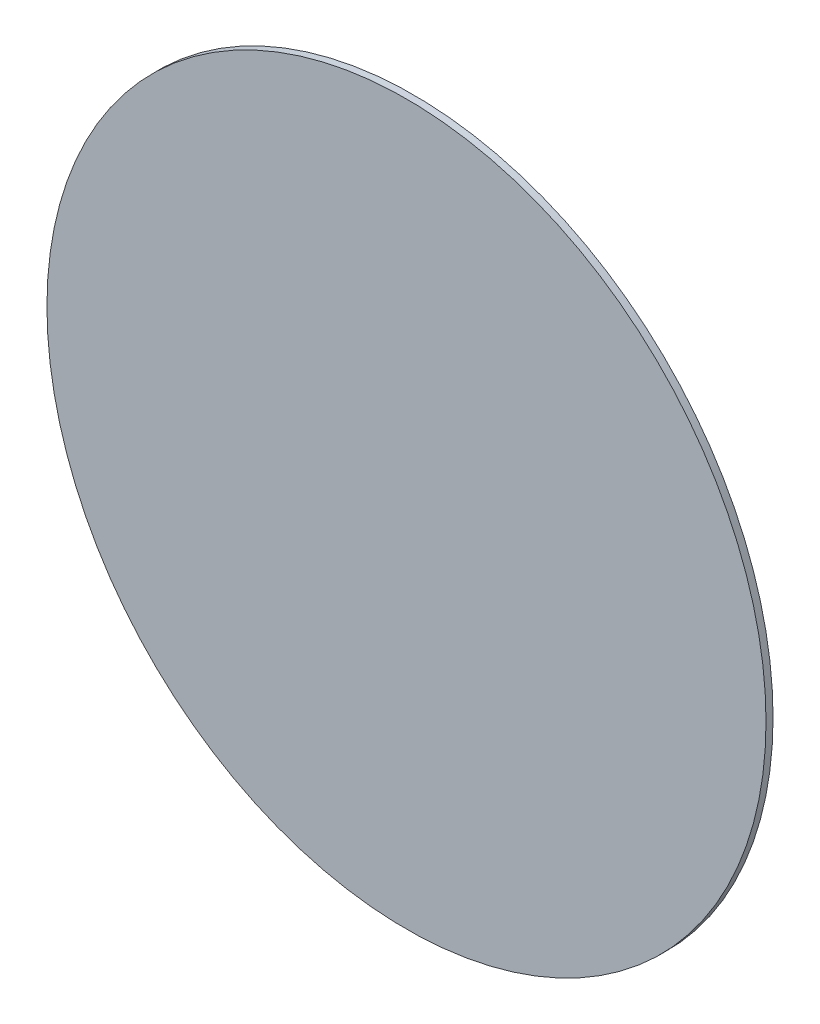
from build123d import *

# Parameters (mm, degrees)
ESQUISSE1_R         = 13.3
BOSS_EXTRU_1_DEPTH  = 0.26
BALAYAGE1_PROFILE_R = 0.125


with BuildPart() as part:
    # Esquisse1 → Boss.-Extru.1 (new body)
    with BuildSketch(Plane.XY):
        Circle(ESQUISSE1_R)
    extrude(amount=BOSS_EXTRU_1_DEPTH)


with BuildPart() as body_2:
    # Balayage1: sweep along a curve in space
    with BuildLine() as balayage1_path:
        add(Edge.make_bspline(
            [(0, -12.115, -0.125), (1.387618568, -12.110260417, -0.125), (2.773256488, -11.864807262, -0.125), (5.380004354, -10.922030278, -0.125), (6.600514993, -10.22493249, -0.125), (8.734753164, -8.461145826, -0.125), (9.647993153, -7.394871199, -0.125), (11.061596095, -5.017978902, -0.125), (11.561639948, -3.707914867, -0.125), (12.091223071, -0.996932111, -0.125), (12.120648557, 0.403358575, -0.125), (11.706449744, 3.131057582, -0.125), (11.262929781, 4.457836991, -0.125), (9.955544639, 6.883673874, -0.125), (9.091989217, 7.982175011, -0.125), (7.046202055, 9.823575173, -0.125), (5.86444883, 10.566055241, -0.125), (3.320910255, 11.609363239, -0.125), (1.959715895, 11.909958198, -0.125), (-0.783364404, 12.035226494, -0.125), (-2.164616166, 11.859879613, -0.125), (-4.786431859, 11.054654814, -0.125), (-6.026392594, 10.424971291, -0.125), (-8.221059365, 8.785493841, -0.125), (-9.175263561, 7.776085706, -0.125), (-10.68750614, 5.495792698, -0.125), (-11.245202406, 4.225439506, -0.125), (-11.90004643, 1.572143517, -0.125), (-11.997051371, 0.189815847, -0.125), (-11.720066637, -2.525748083, -0.125), (-11.346149648, -3.85835781, -0.125), (-10.171902992, -6.318923135, -0.125), (-9.371852515, -7.446313991, -0.125), (-7.439611208, -9.365149732, -0.125), (-6.307872972, -10.156157474, -0.125), (-3.845090777, -11.310480775, -0.125), (-2.514619542, -11.673537541, -0.125), (0.189836756, -11.930378205, -0.125), (1.56319614, -11.824111457, -0.125), (4.192928391, -11.155625797, -0.125), (5.448695821, -10.593569803, -0.125), (7.696790355, -9.080040562, -0.125), (8.688602925, -8.128924256, -0.125), (10.293450065, -5.949125713, -0.125), (10.906120875, -4.720952289, -0.125), (11.681857662, -2.13103609, -0.125), (11.844752775, -0.769894213, -0.125), (11.702786475, 1.926710636, -0.125), (11.397966586, 3.261551027, -0.125), (10.357086705, 5.749687097, -0.125), (9.621275264, 6.902411272, -0.125), (7.805200563, 8.89202576, -0.125), (6.725363354, 9.728462269, -0.125), (4.348040617, 10.988419432, -0.125), (3.051108451, 11.411656695, -0.125), (0.391509452, 11.796588052, -0.125), (-0.970541639, 11.758201854, -0.125), (-3.601156194, 11.225275211, -0.125), (-4.869113597, 10.730866458, -0.125), (-7.163621788, 9.344539699, -0.125), (-8.189646954, 8.452949476, -0.125), (-9.880921788, 6.377183029, -0.125), (-10.545787466, 5.193491922, -0.125), (-11.437795294, 2.672359764, -0.125), (-11.664739583, 1.335504127, -0.125), (-11.655260417, -1.335504127, -0.125), (-11.418847886, -2.669039647, -0.125), (-10.511184555, -5.177651429, -0.125), (-9.840151682, -6.352151056, -0.125), (-8.142487121, -8.405819212, -0.125), (-7.116254404, -9.284518813, -0.125), (-4.8287622, -10.6445374, -0.125), (-3.568035695, -11.125549668, -0.125), (-0.959279091, -11.634798745, -0.125), (0.388146589, -11.662926469, -0.125), (3.012744836, -11.264021209, -0.125), (4.289312309, -10.837089028, -0.125), (6.623227525, -9.578837041, -0.125), (7.680040169, -8.747815639, -0.125), (9.451444491, -6.779256984, -0.125), (10.165633386, -5.642180403, -0.125), (11.169054718, -3.194936759, -0.125), (11.4580634, -1.885338437, -0.125), (11.578217427, 0.753638529, -0.125), (11.409343736, 2.082407048, -0.125), (10.634374985, 4.60448192, -0.125), (10.028467328, 5.797208121, -0.125), (8.45107895, 7.908157471, -0.125), (7.479969676, 8.825898119, -0.125), (5.286339816, 10.280234234, -0.125), (4.064330888, 10.816500962, -0.125), (1.512140172, 11.446019434, -0.125), (0.182550151, 11.539134212, -0.125), (-2.429286789, 11.272365694, -0.125), (-3.710931139, 10.912552725, -0.125), (-6.077274671, 9.782869658, -0.125), (-7.16143088, 9.013268455, -0.125), (-9.006565672, 7.154728097, -0.125), (-9.76712414, 6.066224508, -0.125), (-10.876883852, 3.697664106, -0.125), (-11.225836599, 2.418158248, -0.125), (-11.472461046, -0.182571059, -0.125), (-11.37008446, -1.503192794, -0.125), (-10.726924353, -4.031819773, -0.125), (-10.186297897, -5.239242938, -0.125), (-8.73067512, -7.400674326, -0.125), (-7.816022362, -8.354188034, -0.125), (-5.719941241, -9.896946102, -0.125), (-4.53900235, -10.485841046, -0.125), (-2.048826972, -11.231321786, -0.125), (-0.740168338, -11.387743708, -0.125), (1.852333178, -11.250891677, -0.125), (3.13557753, -10.957658066, -0.125), (5.52741867, -9.956664851, -0.125), (6.635466201, -9.249144582, -0.125), (8.547852182, -7.50306572, -0.125), (9.351754671, -6.464917005, -0.125), (10.562578679, -4.179515935, -0.125), (10.96922816, -2.932795705, -0.125), (11.338865964, -0.376297467, -0.125), (11.301777528, 0.932888619, -0.125), (10.789184931, 3.461277021, -0.125), (10.313807764, 4.679896895, -0.125), (8.981065359, 6.885004992, -0.125), (8.124015524, 7.870988248, -0.125), (6.128819092, 9.496140981, -0.125), (4.991138996, 10.134941743, -0.125), (2.568142923, 10.991835918, -0.125), (1.283389686, 11.209739583, -0.125), (-1.283389686, 11.200260417, -0.125), (-2.564822806, 10.97288851, -0.125), (-4.975298503, 10.100338832, -0.125), (-6.10378712, 9.455370875, -0.125), (-8.076885261, 7.823828415, -0.125), (-8.921044472, 6.837637609, -0.125), (-10.227478706, 4.639545498, -0.125), (-10.689459388, 3.428156522, -0.125), (-11.17837442, 0.92162607, -0.125), (-11.20520438, -0.372934604, -0.125), (-10.821592673, -2.894432089, -0.125), (-10.411248275, -4.120787628, -0.125), (-9.202129443, -6.362781177, -0.125), (-8.403642061, -7.377905326, -0.125), (-6.512311913, -9.07931381, -0.125), (-5.419911976, -9.765211532, -0.125), (-3.068963262, -10.728746198, -0.125), (-1.810960978, -11.006168602, -0.125), (0.723912655, -11.12120836, -0.125), (2.00019793, -10.95880786, -0.125), (4.422531982, -10.214095156, -0.125), (5.568023649, -9.631963366, -0.125), (7.595255576, -8.116664059, -0.125), (8.476532678, -7.183853646, -0.125), (9.872962329, -5.076886934, -0.125), (10.387799517, -3.90322227, -0.125), (10.991992438, -1.452136826, -0.125), (11.081217053, -0.175284454, -0.125), (10.824664752, 2.332825495, -0.125), (10.478955802, 3.563504467, -0.125), (9.393836324, 5.835626207, -0.125), (8.654684395, 6.876547769, -0.125), (6.869844986, 8.647981612, -0.125), (5.824576044, 9.378090806, -0.125), (3.550237434, 10.443286929, -0.125), (2.321696954, 10.778135656, -0.125), (-0.175305363, 11.014543886, -0.125), (-1.443189448, 10.916057464, -0.125), (-3.870711155, 10.298222909, -0.125), (-5.029790056, 9.779025992, -0.125), (-7.104558296, 8.381309678, -0.125), (-8.019773144, 7.503120467, -0.125), (-9.500442139, 5.490756768, -0.125), (-10.065561217, 4.357052412, -0.125), (-10.780785909, 1.966617854, -0.125), (-10.930734641, 0.710442464, -0.125), (-10.798996879, -1.77795572, -0.125), (-10.517349546, -3.009604034, -0.125), (-9.556242997, -5.305150243, -0.125), (-8.877013901, -6.36852113, -0.125), (-7.200930878, -8.203678604, -0.125), (-6.204470657, -8.975047073, -0.125), (-4.010991253, -10.136737926, -0.125), (-2.814482959, -10.526799624, -0.125), (-0.361085481, -10.881143875, -0.125), (0.895235599, -10.845353203, -0.125), (3.321397849, -10.353094652, -0.125), (4.490680194, -9.896749069, -0.125), (6.606388197, -8.617591018, -0.125), (7.552329543, -7.795081573, -0.125), (9.111360174, -5.880455155, -0.125), (9.724096019, -4.788786071, -0.125), (10.545876542, -2.463926082, -0.125), (10.754739583, -1.231275246, -0.125), (10.745260417, 1.231275246, -0.125), (10.526929134, 2.460605965, -0.125), (9.689493108, 4.772945578, -0.125), (9.070590068, 5.855423183, -0.125), (7.50516971, 7.747951309, -0.125), (6.559020813, 8.557570132, -0.125), (4.450328796, 9.810420011, -0.125), (3.288277349, 10.253369109, -0.125), (0.88397305, 10.721950094, -0.125), (-0.357722619, 10.747482291, -0.125), (-2.776119343, 10.379164138, -0.125), (-3.952262946, 9.985407523, -0.125), (-6.102334828, 8.825421845, -0.125), (-7.075770483, 8.059468483, -0.125), (-8.707183129, 6.245366842, -0.125), (-9.364789678, 5.19764355, -0.125), (-10.288437678, 2.942989765, -0.125), (-10.554273804, 1.73658352, -0.125), (-10.664199293, -0.69418678, -0.125), (-10.508271984, -1.917988813, -0.125), (-9.793815327, -4.240582043, -0.125), (-9.235459403, -5.338839177, -0.125), (-7.782249168, -7.282353681, -0.125), (-6.887737616, -8.127167236, -0.125), (-4.867434051, -9.465690423, -0.125), (-3.742113652, -9.959098073, -0.125), (-1.39213348, -10.537965441, -0.125), (-0.168018758, -10.623299894, -0.125), (2.236364201, -10.37696381, -0.125), (3.416077796, -10.045358879, -0.125), (5.593977743, -9.004802991, -0.125), (6.591664658, -8.296100335, -0.125), (8.289397552, -6.584961875, -0.125), (8.989057472, -5.58292758, -0.125), (10.009690006, -3.402810763, -0.125), (10.330434714, -2.22523566, -0.125), (10.556626727, 0.168039666, -0.125), (10.462030467, 1.383186103, -0.125), (9.869521465, 3.709602537, -0.125), (9.371754086, 4.820337174, -0.125), (8.031944237, 6.808442266, -0.125), (7.190218572, 7.685358253, -0.125), (5.261572296, 9.103938176, -0.125), (4.175102473, 9.645281388, -0.125), (1.884408737, 10.330250033, -0.125), (0.680716589, 10.473725574, -0.125), (-1.703578261, 10.347102081, -0.125), (-2.883630537, 10.077041026, -0.125), (-5.082881816, 9.155821143, -0.125), (-6.101576059, 8.50488322, -0.125), (-7.859505026, 6.898796035, -0.125), (-8.598339475, 5.944024308, -0.125), (-9.710897174, 3.842466571, -0.125), (-10.084371089, 2.696170212, -0.125), (-10.423421786, 0.345873496, -0.125), (-10.388928877, -0.857582579, -0.125), (-9.917004372, -3.181518676, -0.125), (-9.479690375, -4.301463492, -0.125), (-8.254116677, -6.327771402, -0.125), (-7.466147621, -7.233670838, -0.125), (-5.632091218, -8.726579366, -0.125), (-4.586433145, -9.313250296, -0.125), (-2.359709241, -10.099917166, -0.125), (-1.179160805, -10.299739583, -0.125), (1.179160805, -10.290260417, -0.125), (2.356389124, -10.080969758, -0.125), (4.570592652, -9.278647385, -0.125), (5.607059246, -8.68580926, -0.125), (7.419017357, -7.186511005, -0.125), (8.194095791, -6.280404018, -0.125), (9.393361317, -4.261112095, -0.125), (9.817278829, -3.148398176, -0.125), (10.265525769, -0.84632003, -0.125), (10.289760203, 0.342510633, -0.125), (9.936735603, 2.657806596, -0.125), (9.55956677, 3.783738264, -0.125), (8.448714247, 5.841888479, -0.125), (7.715294905, 6.77363564, -0.125), (5.978421771, 8.335052447, -0.125), (4.975375123, 8.964367823, -0.125), (2.817016269, 9.848129157, -0.125), (1.662206062, 10.102379006, -0.125), (-0.664460905, 10.207190226, -0.125), (-1.835779695, 10.057736107, -0.125), (-4.058632105, 9.373535498, -0.125), (-5.109654704, 8.83895544, -0.125), (-6.969451786, 7.447834277, -0.125), (-7.777801794, 6.591621587, -0.125), (-9.058418518, 4.657981169, -0.125), (-9.530396629, 3.581005034, -0.125), (-10.083938445, 1.332130135, -0.125), (-10.165382735, 0.160753061, -0.125), (-9.929262868, -2.139902907, -0.125), (-9.611761956, -3.268651125, -0.125), (-8.615769657, -5.352329279, -0.125), (-7.937516275, -6.306781547, -0.125), (-6.300078764, -7.930813492, -0.125), (-5.341279116, -8.600024138, -0.125), (-3.255384092, -9.576093083, -0.125), (-2.128774366, -9.882733772, -0.125), (0.16077397, -10.098709568, -0.125), (1.323182757, -10.008003471, -0.125), (3.548493919, -9.440820021, -0.125), (4.610884291, -8.96448218, -0.125), (6.512326236, -7.682578795, -0.125), (7.350943362, -6.877316677, -0.125), (8.707434213, -5.032387824, -0.125), (9.225001559, -3.993152535, -0.125), (9.879714157, -1.802199619, -0.125), (10.016716507, -0.650990714, -0.125), (9.895207283, 1.629200803, -0.125), (9.636732505, 2.75765704, -0.125), (8.755399288, 4.860613389, -0.125), (8.132752538, 5.834630988, -0.125), (6.596661192, 7.515331448, -0.125), (5.68357796, 8.221631877, -0.125), (3.673941889, 9.285056421, -0.125), (2.577857466, 9.641942553, -0.125), (0.330661511, 9.965699698, -0.125), (-0.819929558, 9.932504552, -0.125), (-3.041639503, 9.480914092, -0.125), (-4.11224679, 9.06263168, -0.125), (-6.049154606, 7.890642337, -0.125), (-6.915012133, 7.137213669, -0.125), (-8.341798559, 5.383727281, -0.125), (-8.902404572, 4.384080219, -0.125), (-9.65395779, 2.2554924, -0.125), (-9.844739583, 1.127046364, -0.125), (-9.835260417, -1.127046364, -0.125), (-9.635010382, -2.252172283, -0.125), (-8.867801661, -4.368239727, -0.125), (-8.301028453, -5.358695309, -0.125), (-6.8678523, -7.090083406, -0.125), (-6.001787223, -7.83062145, -0.125), (-4.071895393, -8.976302622, -0.125), (-3.008519003, -9.38118855, -0.125), (-0.80866701, -9.809101443, -0.125), (0.327298648, -9.832038114, -0.125), (2.53949385, -9.494307067, -0.125), (3.615213582, -9.133726018, -0.125), (5.581442131, -8.072006649, -0.125), (6.471500798, -7.371121327, -0.125), (7.962921766, -5.7114767, -0.125), (8.563945969, -4.753106696, -0.125), (9.407820637, -2.691042772, -0.125), (9.650484207, -1.587828603, -0.125), (9.750181159, 0.63473503, -0.125), (9.607200231, 1.753570577, -0.125), (8.953255668, 3.876682166, -0.125), (8.442451477, 4.880470232, -0.125), (7.113419387, 6.656549892, -0.125), (6.295505557, 7.428436353, -0.125), (4.448528287, 8.651146612, -0.125), (3.419896416, 9.101695185, -0.125), (1.272126789, 9.629911449, -0.125), (0.153487365, 9.707465576, -0.125), (-2.043441612, 9.481561926, -0.125), (-3.121224454, 9.178165033, -0.125), (-5.110680815, 8.226736323, -0.125), (-6.021898436, 7.578932216, -0.125), (-7.572229432, 6.015195653, -0.125), (-8.210990805, 5.099630652, -0.125), (-9.14249616, 3.107957421, -0.125), (-9.43503283, 2.032313071, -0.125), (-9.640792409, -0.153508273, -0.125), (-9.553976475, -1.263179411, -0.125), (-9.012118577, -3.387385301, -0.125), (-8.557210275, -4.401431409, -0.125), (-7.333213353, -6.216210207, -0.125), (-6.564414783, -7.016528471, -0.125), (-4.803203351, -8.310930251, -0.125), (-3.811202596, -8.804721729, -0.125), (-1.719990501, -9.42917828, -0.125), (-0.62126484, -9.55970744, -0.125), (1.554823345, -9.443312485, -0.125), (2.631683544, -9.196423985, -0.125), (4.638344963, -8.354977434, -0.125), (5.567685917, -7.760621857, -0.125), (7.17115787, -6.294526349, -0.125), (7.844924279, -5.423131611, -0.125), (8.859215669, -3.505417207, -0.125), (9.199514018, -2.45954472, -0.125), (9.507977609, -0.315449525, -0.125), (9.476080226, 0.782276538, -0.125), (9.044823813, 2.90176033, -0.125), (8.645572986, 3.923030088, -0.125), (7.527167996, 5.770537811, -0.125), (6.808279717, 6.596353428, -0.125), (5.135363344, 7.957017751, -0.125), (4.181727294, 8.491558849, -0.125), (2.151275559, 9.207998414, -0.125), (1.074931924, 9.389739583, -0.125), (-1.074931924, 9.380260417, -0.125), (-2.147955442, 9.189051006, -0.125), (-4.165886801, 8.456955938, -0.125), (-5.110331372, 7.916247645, -0.125), (-6.761149454, 6.549193595, -0.125), (-7.46714711, 5.723170427, -0.125), (-8.559243928, 3.882678691, -0.125), (-8.94509827, 2.868639831, -0.125), (-9.352677117, 0.771013989, -0.125), (-9.374316025, -0.312086662, -0.125), (-9.051878532, -2.421181104, -0.125), (-8.707885265, -3.4466889, -0.125), (-7.695299051, -5.320995782, -0.125), (-7.026947749, -6.169365955, -0.125), (-5.444531629, -7.590791085, -0.125), (-4.530838269, -8.163524115, -0.125), (-2.565069275, -8.967512117, -0.125), (-1.513451145, -9.198589409, -0.125), (0.605009156, -9.293172092, -0.125), (1.671361459, -9.156664355, -0.125), (3.694732228, -8.532975839, -0.125), (4.65128576, -8.045947514, -0.125), (6.343647997, -6.779004496, -0.125), (7.079070911, -5.999389527, -0.125), (8.243874707, -4.239075405, -0.125), (8.672993741, -3.258787798, -0.125), (9.175884452, -1.212123443, -0.125), (9.249548417, -0.146221668, -0.125), (9.033860983, 1.946980318, -0.125), (8.74456811, 2.973797783, -0.125), (7.837702989, 4.869032351, -0.125), (7.220348156, 5.737015325, -0.125), (5.730312542, 7.213645373, -0.125), (4.857982188, 7.821957471, -0.125), (2.96053075, 8.708899237, -0.125), (1.935851777, 8.987331888, -0.125), (-0.146242577, 9.18287525, -0.125), (-1.203176066, 9.099949478, -0.125), (-3.226276683, 8.583417133, -0.125), (-4.191978527, 8.149938369, -0.125), (-5.920094177, 6.983847911, -0.125), (-6.68211358, 6.251512888, -0.125), (-7.914426288, 4.574018879, -0.125), (-8.3844419, 3.629252658, -0.125), (-8.978642404, 1.637781383, -0.125), (-9.102698373, 0.591538965, -0.125), (-8.991417686, -1.480445886, -0.125), (-8.756115465, -2.505710047, -0.125), (-7.95455558, -4.416076536, -0.125), (-7.388491176, -5.300740845, -0.125), (-5.992391507, -6.826984293, -0.125), (-5.162685262, -7.468216681, -0.125), (-3.336892526, -8.433374916, -0.125), (-2.341231973, -8.757085483, -0.125), (-0.30023754, -9.05025552, -0.125), (0.744623518, -9.0196559, -0.125), (2.761881157, -8.608733533, -0.125), (3.733813386, -8.228514291, -0.125), (5.491921016, -7.163693656, -0.125), (6.277694723, -6.479345766, -0.125), (7.572236944, -4.886999407, -0.125), (8.080713126, -3.979374368, -0.125), (8.762039038, -2.047058718, -0.125), (8.934739583, -1.022817483, -0.125), (8.925260417, 1.022817483, -0.125), (8.74309163, 2.043738601, -0.125), (8.046110215, 3.963533875, -0.125), (7.531466838, 4.861967435, -0.125), (6.23053489, 6.432215502, -0.125), (5.444553632, 7.103672769, -0.125), (3.693461989, 8.142185233, -0.125), (2.728760658, 8.50900799, -0.125), (0.733360969, 8.896252792, -0.125), (-0.296874677, 8.916593937, -0.125), (-2.302868357, 8.609449996, -0.125), (-3.278164218, 8.282044513, -0.125), (-5.060549433, 7.318591453, -0.125), (-5.867231112, 6.682774171, -0.125), (-7.218660403, 5.177586558, -0.125), (-7.763102261, 4.308569843, -0.125), (-8.527203596, 2.439095779, -0.125), (-8.746694611, 1.439073687, -0.125), (-8.836163025, -0.575283281, -0.125), (-8.706128478, -1.589152341, -0.125), (-8.11269601, -3.512782289, -0.125), (-7.649443551, -4.422101287, -0.125), (-6.444589605, -6.030746102, -0.125), (-5.703273497, -6.729705469, -0.125), (-4.029622522, -7.836602801, -0.125), (-3.09767918, -8.244292297, -0.125), (-1.152120098, -8.721857456, -0.125), (-0.138955972, -8.791631258, -0.125), (1.850519024, -8.586160041, -0.125), (2.826371112, -8.310971187, -0.125), (4.627383888, -7.448669655, -0.125), (5.452132214, -6.861764096, -0.125), (6.855061313, -5.445429431, -0.125), (7.432924137, -4.616333725, -0.125), (8.275302314, -2.813104079, -0.125), (8.539630945, -1.839390483, -0.125), (8.724958091, 0.13897688, -0.125), (8.645922482, 1.14317272, -0.125), (8.154715689, 3.065168065, -0.125), (7.742666464, 3.982525645, -0.125), (6.63448247, 5.623978147, -0.125), (5.938610993, 6.34769869, -0.125), (4.344834407, 7.517922325, -0.125), (3.447302719, 7.964162071, -0.125), (1.555572265, 8.528106528, -0.125), (0.56181309, 8.645689306, -0.125), (-1.406068428, 8.539522888, -0.125), (-2.37973655, 8.315806944, -0.125), (-4.193808109, 7.554133725, -0.125), (-5.033795774, 7.016360494, -0.125), (-6.482810715, 5.690256664, -0.125), (-7.091509083, 4.902238914, -0.125), (-8.007534164, 3.168367844, -0.125), (-8.314656947, 2.222919227, -0.125), (-8.592533432, 0.285025555, -0.125), (-8.563231575, -0.706970498, -0.125), (-8.172643254, -2.622001985, -0.125), (-7.811455597, -3.544596684, -0.125), (-6.800219315, -5.21330422, -0.125), (-6.150411814, -5.959036018, -0.125), (-4.63863547, -7.187456136, -0.125), (-3.777021443, -7.669867402, -0.125), (-1.942841877, -8.316079662, -0.125), (-0.970703043, -8.479739583, -0.125), (0, -8.475, -0.125)],
            knots=[0, 0, 0, 0, 0.00390625, 0.00390625, 0.0078125, 0.0078125, 0.01171875, 0.01171875, 0.015625, 0.015625, 0.01953125, 0.01953125, 0.0234375, 0.0234375, 0.02734375, 0.02734375, 0.03125, 0.03125, 0.03515625, 0.03515625, 0.0390625, 0.0390625, 0.04296875, 0.04296875, 0.046875, 0.046875, 0.05078125, 0.05078125, 0.0546875, 0.0546875, 0.05859375, 0.05859375, 0.0625, 0.0625, 0.06640625, 0.06640625, 0.0703125, 0.0703125, 0.07421875, 0.07421875, 0.078125, 0.078125, 0.08203125, 0.08203125, 0.0859375, 0.0859375, 0.08984375, 0.08984375, 0.09375, 0.09375, 0.09765625, 0.09765625, 0.1015625, 0.1015625, 0.10546875, 0.10546875, 0.109375, 0.109375, 0.11328125, 0.11328125, 0.1171875, 0.1171875, 0.12109375, 0.12109375, 0.125, 0.125, 0.12890625, 0.12890625, 0.1328125, 0.1328125, 0.13671875, 0.13671875, 0.140625, 0.140625, 0.14453125, 0.14453125, 0.1484375, 0.1484375, 0.15234375, 0.15234375, 0.15625, 0.15625, 0.16015625, 0.16015625, 0.1640625, 0.1640625, 0.16796875, 0.16796875, 0.171875, 0.171875, 0.17578125, 0.17578125, 0.1796875, 0.1796875, 0.18359375, 0.18359375, 0.1875, 0.1875, 0.19140625, 0.19140625, 0.1953125, 0.1953125, 0.19921875, 0.19921875, 0.203125, 0.203125, 0.20703125, 0.20703125, 0.2109375, 0.2109375, 0.21484375, 0.21484375, 0.21875, 0.21875, 0.22265625, 0.22265625, 0.2265625, 0.2265625, 0.23046875, 0.23046875, 0.234375, 0.234375, 0.23828125, 0.23828125, 0.2421875, 0.2421875, 0.24609375, 0.24609375, 0.25, 0.25, 0.25390625, 0.25390625, 0.2578125, 0.2578125, 0.26171875, 0.26171875, 0.265625, 0.265625, 0.26953125, 0.26953125, 0.2734375, 0.2734375, 0.27734375, 0.27734375, 0.28125, 0.28125, 0.28515625, 0.28515625, 0.2890625, 0.2890625, 0.29296875, 0.29296875, 0.296875, 0.296875, 0.30078125, 0.30078125, 0.3046875, 0.3046875, 0.30859375, 0.30859375, 0.3125, 0.3125, 0.31640625, 0.31640625, 0.3203125, 0.3203125, 0.32421875, 0.32421875, 0.328125, 0.328125, 0.33203125, 0.33203125, 0.3359375, 0.3359375, 0.33984375, 0.33984375, 0.34375, 0.34375, 0.34765625, 0.34765625, 0.3515625, 0.3515625, 0.35546875, 0.35546875, 0.359375, 0.359375, 0.36328125, 0.36328125, 0.3671875, 0.3671875, 0.37109375, 0.37109375, 0.375, 0.375, 0.37890625, 0.37890625, 0.3828125, 0.3828125, 0.38671875, 0.38671875, 0.390625, 0.390625, 0.39453125, 0.39453125, 0.3984375, 0.3984375, 0.40234375, 0.40234375, 0.40625, 0.40625, 0.41015625, 0.41015625, 0.4140625, 0.4140625, 0.41796875, 0.41796875, 0.421875, 0.421875, 0.42578125, 0.42578125, 0.4296875, 0.4296875, 0.43359375, 0.43359375, 0.4375, 0.4375, 0.44140625, 0.44140625, 0.4453125, 0.4453125, 0.44921875, 0.44921875, 0.453125, 0.453125, 0.45703125, 0.45703125, 0.4609375, 0.4609375, 0.46484375, 0.46484375, 0.46875, 0.46875, 0.47265625, 0.47265625, 0.4765625, 0.4765625, 0.48046875, 0.48046875, 0.484375, 0.484375, 0.48828125, 0.48828125, 0.4921875, 0.4921875, 0.49609375, 0.49609375, 0.5, 0.5, 0.50390625, 0.50390625, 0.5078125, 0.5078125, 0.51171875, 0.51171875, 0.515625, 0.515625, 0.51953125, 0.51953125, 0.5234375, 0.5234375, 0.52734375, 0.52734375, 0.53125, 0.53125, 0.53515625, 0.53515625, 0.5390625, 0.5390625, 0.54296875, 0.54296875, 0.546875, 0.546875, 0.55078125, 0.55078125, 0.5546875, 0.5546875, 0.55859375, 0.55859375, 0.5625, 0.5625, 0.56640625, 0.56640625, 0.5703125, 0.5703125, 0.57421875, 0.57421875, 0.578125, 0.578125, 0.58203125, 0.58203125, 0.5859375, 0.5859375, 0.58984375, 0.58984375, 0.59375, 0.59375, 0.59765625, 0.59765625, 0.6015625, 0.6015625, 0.60546875, 0.60546875, 0.609375, 0.609375, 0.61328125, 0.61328125, 0.6171875, 0.6171875, 0.62109375, 0.62109375, 0.625, 0.625, 0.62890625, 0.62890625, 0.6328125, 0.6328125, 0.63671875, 0.63671875, 0.640625, 0.640625, 0.64453125, 0.64453125, 0.6484375, 0.6484375, 0.65234375, 0.65234375, 0.65625, 0.65625, 0.66015625, 0.66015625, 0.6640625, 0.6640625, 0.66796875, 0.66796875, 0.671875, 0.671875, 0.67578125, 0.67578125, 0.6796875, 0.6796875, 0.68359375, 0.68359375, 0.6875, 0.6875, 0.69140625, 0.69140625, 0.6953125, 0.6953125, 0.69921875, 0.69921875, 0.703125, 0.703125, 0.70703125, 0.70703125, 0.7109375, 0.7109375, 0.71484375, 0.71484375, 0.71875, 0.71875, 0.72265625, 0.72265625, 0.7265625, 0.7265625, 0.73046875, 0.73046875, 0.734375, 0.734375, 0.73828125, 0.73828125, 0.7421875, 0.7421875, 0.74609375, 0.74609375, 0.75, 0.75, 0.75390625, 0.75390625, 0.7578125, 0.7578125, 0.76171875, 0.76171875, 0.765625, 0.765625, 0.76953125, 0.76953125, 0.7734375, 0.7734375, 0.77734375, 0.77734375, 0.78125, 0.78125, 0.78515625, 0.78515625, 0.7890625, 0.7890625, 0.79296875, 0.79296875, 0.796875, 0.796875, 0.80078125, 0.80078125, 0.8046875, 0.8046875, 0.80859375, 0.80859375, 0.8125, 0.8125, 0.81640625, 0.81640625, 0.8203125, 0.8203125, 0.82421875, 0.82421875, 0.828125, 0.828125, 0.83203125, 0.83203125, 0.8359375, 0.8359375, 0.83984375, 0.83984375, 0.84375, 0.84375, 0.84765625, 0.84765625, 0.8515625, 0.8515625, 0.85546875, 0.85546875, 0.859375, 0.859375, 0.86328125, 0.86328125, 0.8671875, 0.8671875, 0.87109375, 0.87109375, 0.875, 0.875, 0.87890625, 0.87890625, 0.8828125, 0.8828125, 0.88671875, 0.88671875, 0.890625, 0.890625, 0.89453125, 0.89453125, 0.8984375, 0.8984375, 0.90234375, 0.90234375, 0.90625, 0.90625, 0.91015625, 0.91015625, 0.9140625, 0.9140625, 0.91796875, 0.91796875, 0.921875, 0.921875, 0.92578125, 0.92578125, 0.9296875, 0.9296875, 0.93359375, 0.93359375, 0.9375, 0.9375, 0.94140625, 0.94140625, 0.9453125, 0.9453125, 0.94921875, 0.94921875, 0.953125, 0.953125, 0.95703125, 0.95703125, 0.9609375, 0.9609375, 0.96484375, 0.96484375, 0.96875, 0.96875, 0.97265625, 0.97265625, 0.9765625, 0.9765625, 0.98046875, 0.98046875, 0.984375, 0.984375, 0.98828125, 0.98828125, 0.9921875, 0.9921875, 0.99609375, 0.99609375, 1, 1, 1, 1], degree=3))
    # Balayage1 profile (on start of the path) → Balayage1 (sweep)
    with BuildSketch(Plane(origin=(0, -12.115, -0.125), x_dir=(-0.00341560411261405, 0.9999941668072599, 0), z_dir=(0.9999941668072599, 0.00341560411261405, 0))):
        Circle(BALAYAGE1_PROFILE_R)
    sweep(path=balayage1_path.line, is_frenet=True)


solid = Compound([part.part, body_2.part])
